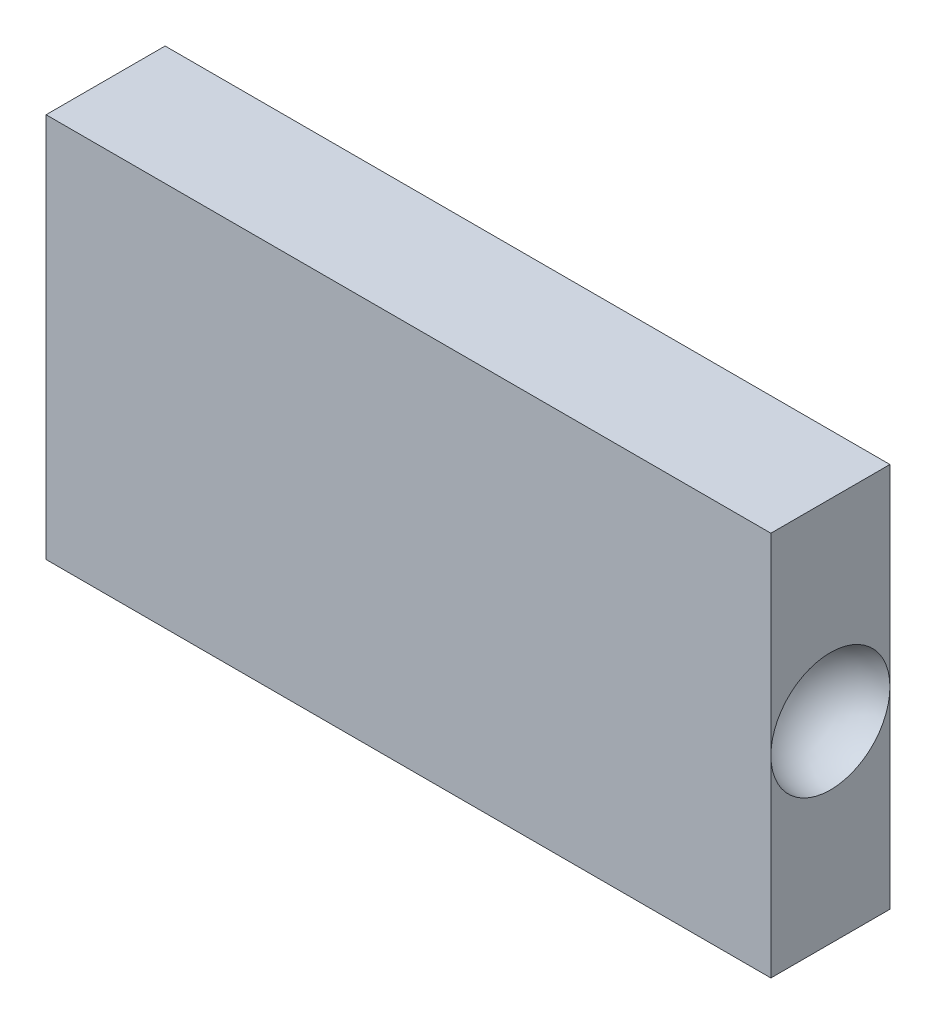
from build123d import *
from build123d.topology import SkipClean

# Parameters (mm, degrees)
SKETCH_2_W      = 60.888503838
SKETCH_2_H      = 32.359912294
EXTRUDE_1_DEPTH = 10


with BuildPart() as part:
    # 草图2 → 凸台-拉伸1 (new body)
    with BuildSketch(Plane.XY):
        Rectangle(SKETCH_2_W, SKETCH_2_H)
    extrude(amount=EXTRUDE_1_DEPTH)

    # 草图5 → 切除-旋转5 (revolve, cut)
    with BuildSketch(Plane(origin=(0, 0, 0), x_dir=(1, 0, 0), z_dir=(0, 1, 0))):
        with BuildLine():
            Line((-30.444251919, 0), (-30.444251919, -10))
            ThreePointArc((-30.444251919, -10), (-25.444251919, -5), (-30.444251919, 0))
        make_face()
    cut_revolve_5 = revolve(axis=Axis((-30.444251919, 0, 0), (0, 0, 1)), mode=Mode.SUBTRACT)

    # 镜向1: 切除-旋转5 across plane
    with SkipClean():  # the faces are left unmerged after this step: merging them gives an invalid solid
        add(cut_revolve_5.mirror(Plane(origin=(0, 0, 0), x_dir=(0, 0, 1), z_dir=(1, 0, 0))), mode=Mode.SUBTRACT)

    # 草图6 → 切除-旋转6 (revolve, cut)
    with SkipClean():  # the faces are left unmerged after this step: merging them gives an invalid solid
        with BuildSketch(Plane(origin=(0, 0, 0), x_dir=(1, 0, 0), z_dir=(0, 1, 0))):
            with BuildLine():
                Line((-4.913926023, 0), (4.913926023, 0))
                ThreePointArc((4.913926023, 0), (0, -4.913926023), (-4.913926023, 0))
            make_face()
        revolve(axis=Axis((-4.913926023, 0, 0), (1, 0, 0)), mode=Mode.SUBTRACT)


solid = part.part
